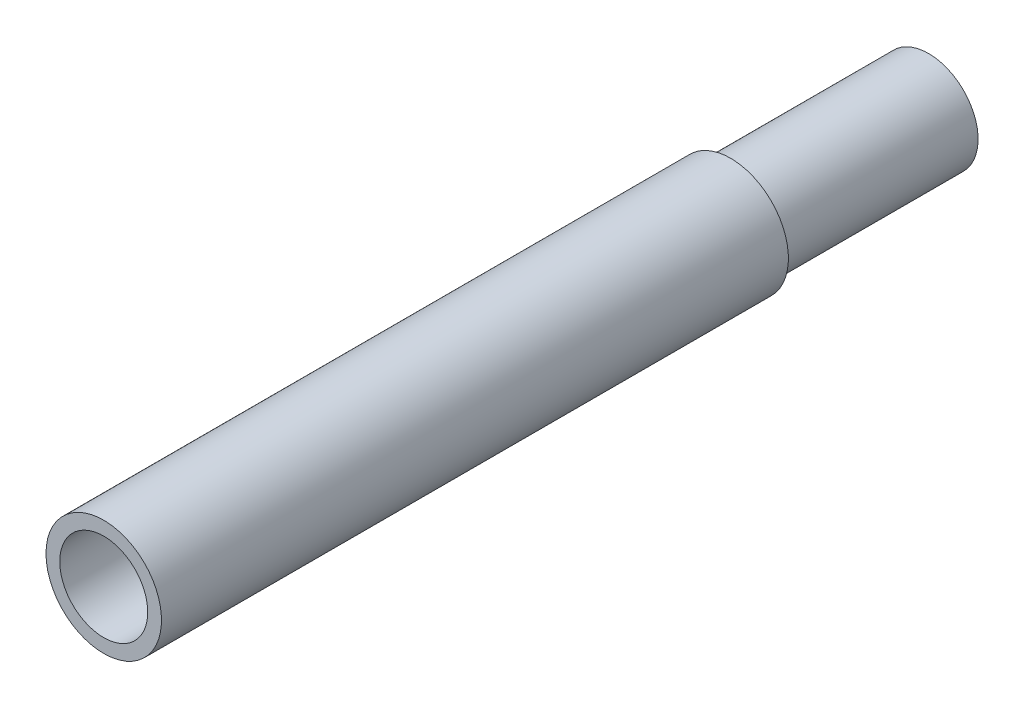
from build123d import *

# Parameters (mm, degrees)
SKETCH2_R           = 10.5
SKETCH2_R_2         = 8
BOSS_EXTRUDE1_DEPTH = 114
BOSS_EXTRUDE2_START = 36
SKETCH4_R           = 9
SKETCH4_R_2         = 8
BOSS_EXTRUDE2_DEPTH = 36


with BuildPart() as part:
    # Sketch2 → Boss-Extrude1 (new body)
    with BuildSketch(Plane.XY):
        with Locations(Location((0, 0, 0), (0, 0, 180))):
            Circle(SKETCH2_R)
        with Locations(Location((0, 0, 0), (0, 0, 180))):
            Circle(SKETCH2_R_2, mode=Mode.SUBTRACT)
    extrude(amount=BOSS_EXTRUDE1_DEPTH)

    # Sketch4 → Boss-Extrude2 (add)
    with BuildSketch(Plane(origin=(0, 0, 0), x_dir=(-1, 0, 0), z_dir=(0, 0, -1)).offset(BOSS_EXTRUDE2_START)):
        Circle(SKETCH4_R)
        Circle(SKETCH4_R_2, mode=Mode.SUBTRACT)
    extrude(amount=-BOSS_EXTRUDE2_DEPTH)


solid = part.part
